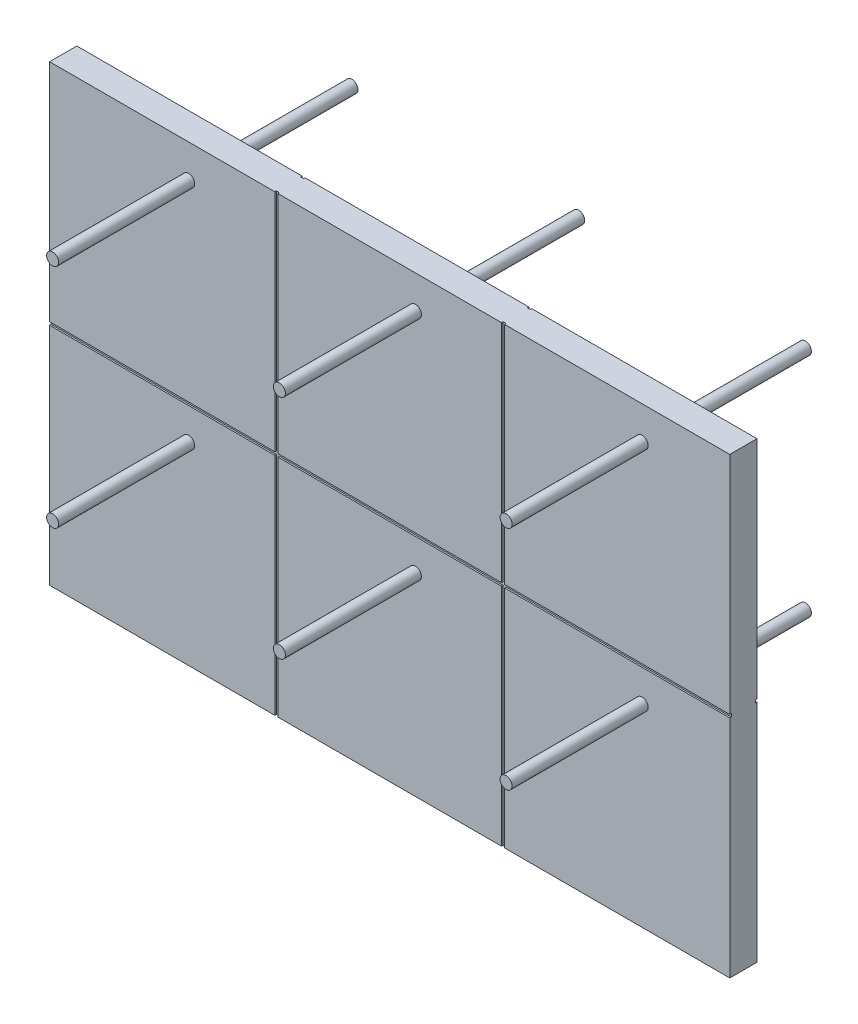
from build123d import *

# Parameters (mm, degrees)
SKETCH1_W           = 450
SKETCH1_H           = 300
BOSS_EXTRUDE1_DEPTH = 9
CUT_EXTRUDE2_DEPTH  = 1
SKETCH5_R           = 4
BOSS_EXTRUDE3_DEPTH = 90


with BuildPart() as part:
    # Sketch1 → Boss-Extrude1 (new, symmetric)
    with BuildSketch(Plane.XY):
        Rectangle(SKETCH1_W, SKETCH1_H)
    extrude(amount=BOSS_EXTRUDE1_DEPTH, both=True)

    # Sketch3 → Cut-Extrude2 (cut)
    with BuildSketch(Plane.XY.offset(9)):
        Polygon((-225, 1), (-225, -1), (-76, -1), (-76, -150), (-74, -150), (-74, -1), (74, -1), (74, -150), (76, -150), (76, -1), (225, -1), (225, 1), (76, 1), (76, 150), (74, 150), (74, 1), (-74, 1), (-74, 150), (-76, 150), (-76, 1), align=None)
    cut_extrude2 = extrude(amount=-CUT_EXTRUDE2_DEPTH, mode=Mode.SUBTRACT)

    # Sketch5 → Boss-Extrude3 (add)
    with BuildSketch(Plane.XY.offset(9)):
        with Locations((-133, 128)):
            Circle(SKETCH5_R)
        with Locations((17, 128)):
            Circle(SKETCH5_R)
        with Locations((167, 128)):
            Circle(SKETCH5_R)
        with Locations((17, -22)):
            Circle(SKETCH5_R)
        with Locations((167, -22)):
            Circle(SKETCH5_R)
        with Locations((-133, -22)):
            Circle(SKETCH5_R)
    boss_extrude3 = extrude(amount=BOSS_EXTRUDE3_DEPTH)

    # Mirror1: Cut-Extrude2, Boss-Extrude3 across plane
    add(cut_extrude2.mirror(Plane.XY), mode=Mode.SUBTRACT)
    add(boss_extrude3.mirror(Plane.XY))


solid = part.part
